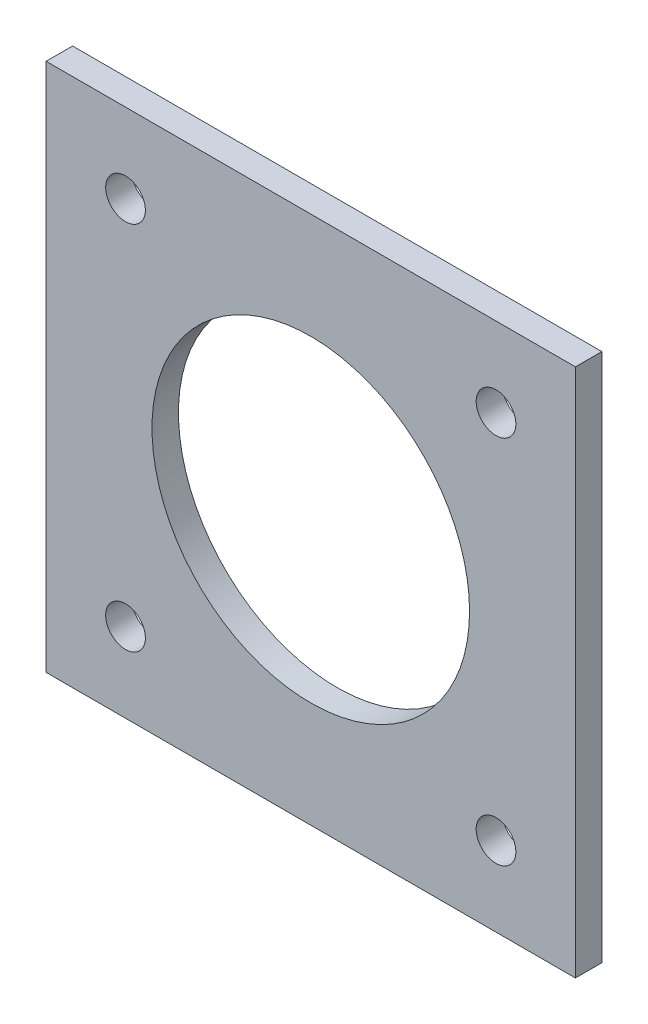
from build123d import *

# Parameters (mm, degrees)
ESQUISSE1_W      = 40
ESQUISSE1_H      = 40
ESQUISSE1_R      = 12
ESQUISSE1_R_2    = 1.5
EXTRUSION1_DEPTH = 2


with BuildPart() as part:
    # Esquisse1 → Extrusion1 (new body)
    with BuildSketch(Plane.XY):
        with Locations((3.156742184, 8.225637105)):
            Rectangle(ESQUISSE1_W, ESQUISSE1_H)
        with Locations((3.156742184, 8.225637105)):
            Circle(ESQUISSE1_R, mode=Mode.SUBTRACT)
        with Locations((-10.843257816, 22.225637105)):
            Circle(ESQUISSE1_R_2, mode=Mode.SUBTRACT)
        with Locations((17.156742184, 22.225637105)):
            Circle(ESQUISSE1_R_2, mode=Mode.SUBTRACT)
        with Locations((-10.843257816, -5.774362895)):
            Circle(ESQUISSE1_R_2, mode=Mode.SUBTRACT)
        with Locations((17.156742184, -5.774362895)):
            Circle(ESQUISSE1_R_2, mode=Mode.SUBTRACT)
    extrude(amount=EXTRUSION1_DEPTH)


solid = part.part
